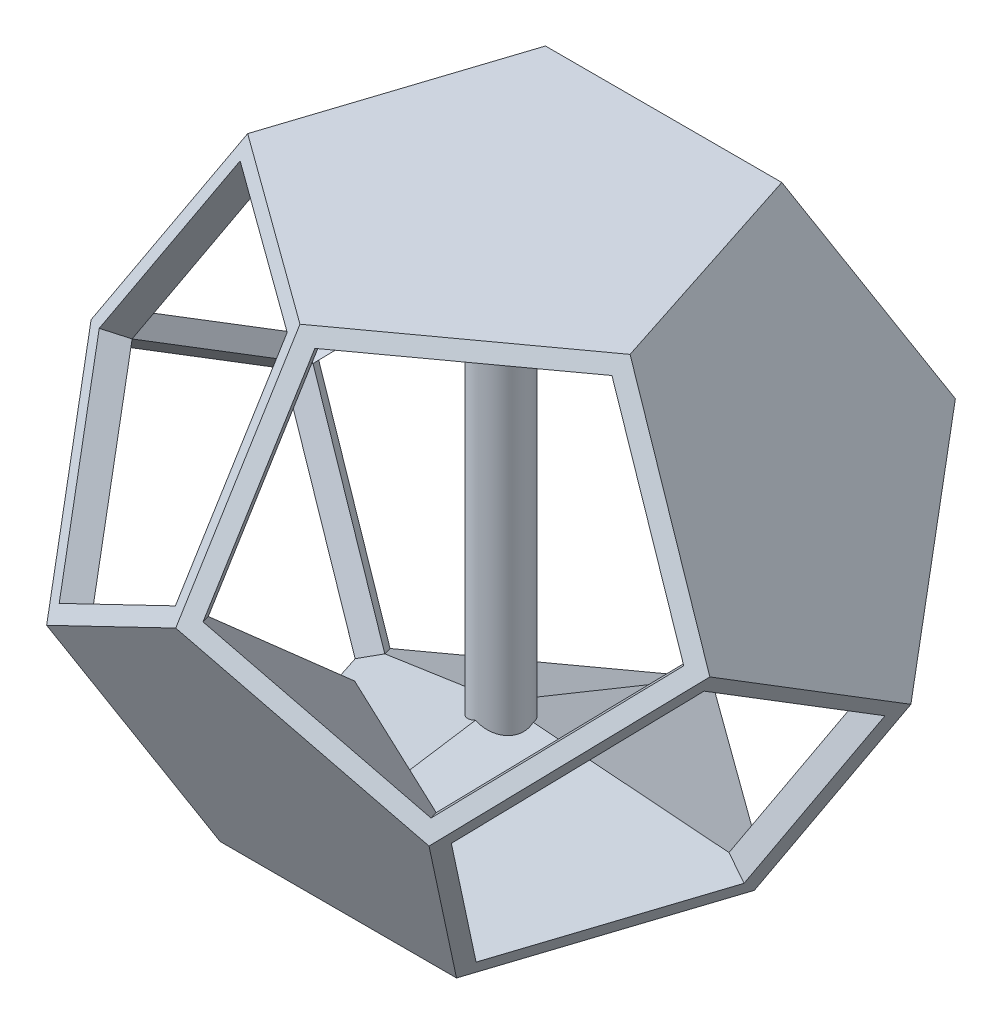
from build123d import *

# Parameters (mm, degrees)
CREATION_EXTRUDE_DEPTH = 130.901699304
CREATION_EXTRUDE_TAPER = -26.56505118
SKETCH2_OUTSIDE_W      = 455.432
SKETCH2_OUTSIDE_H      = 443.246
CREATION_CUT_DEPTH     = 130.901699304
CREATION_CUT_TAPER     = 26.56505118
CUT_EXTRUDE_B_DEPTH    = 50.8
C_INV_DEPTH            = 50.8
CUT_EXTRUDE_D_DEPTH    = 50.8
D_INV_DEPTH            = 50.8
CUT_EXTRUDE_E_DEPTH    = 50.8
E_INV_DEPTH            = 50.8
CUT_EXTRUDE_F_DEPTH    = 50.8
F_INV_DEPTH            = 50.8
SKETCH17_R             = 6.35
BOSS_EXTRUDE1_DEPTH    = 127


with BuildPart() as part:
    # Sketch1 → creation_extrude (new body)
    with BuildSketch(Plane(origin=(0, 0, 0), x_dir=(1, 0, 0), z_dir=(0, 1, 0))):
        Polygon((0, 49.999999949), (-47.552825766, 15.450849703), (-29.389262585, -40.450849677), (29.389262585, -40.450849677), (47.552825766, 15.450849703), align=None)
    extrude(amount=CREATION_EXTRUDE_DEPTH, taper=CREATION_EXTRUDE_TAPER)

    # Sketch2 outside → creation_cut (cut)
    with BuildSketch(Plane(origin=(0, 130.901699304, 0), x_dir=(1, 0, 0), z_dir=(0, 1, 0))):
        with Locations((0, 12.5)):
            Rectangle(SKETCH2_OUTSIDE_W, SKETCH2_OUTSIDE_H)
        Polygon((0, -49.999999949), (47.552825766, -15.450849703), (29.389262585, 40.450849677), (-29.389262585, 40.450849677), (-47.552825766, -15.450849703), align=None, mode=Mode.SUBTRACT)
    extrude(amount=-CREATION_CUT_DEPTH, taper=CREATION_CUT_TAPER, mode=Mode.SUBTRACT)

    # Sketch5 → Cut-Extrude B (cut)
    with BuildSketch(Plane(origin=(0, 42.360679738, -84.721359466), x_dir=(-1, 0, 0), z_dir=(-9.08060963965006e-15, 0.4472135955455734, -0.8944271909771081))):
        Polygon((-42.797543189, 44.635254864), (1e-09, 13.541019643), (42.79754319, 44.635254866), (26.450336325, 94.946784308), (-26.450336327, 94.946784307), align=None)
    extrude(amount=-CUT_EXTRUDE_B_DEPTH, mode=Mode.SUBTRACT)

    # Sketch8 → C_inv (cut)
    with BuildSketch(Plane(origin=(-30.776835339, -16.180339872, 9.999999989), x_dir=(0.2446443083020028, 0.12861712429362696, 0.9610446387935747), z_dir=(-0.8506508083303469, -0.4472135955455736, 0.27639320224297786))):
        Polygon((-31.935023341, 77.848060657), (-22.992425992, 25.708717357), (29.358450763, 18.101689683), (52.77047459, 65.539631327), (14.889024305, 102.464919293), align=None)
    extrude(amount=-C_INV_DEPTH, mode=Mode.SUBTRACT)

    # Sketch9 → Cut-Extrude D (cut)
    with BuildSketch(Plane(origin=(49.797965648, 42.360679738, 68.541019594), x_dir=(0.8506508083603209, -0.27639320226847824, -0.44721359547279954), z_dir=(0.5257311121057348, 0.44721359554557366, 0.7236067977315217))):
        Polygon((-4.184405192, 98.473361345), (-54.495934634, 82.126154482), (-54.495934634, 29.22548183), (-4.184405192, 12.878274966), (26.90983003, 55.675818156), align=None)
    extrude(amount=-CUT_EXTRUDE_D_DEPTH, mode=Mode.SUBTRACT)

    # Sketch10 → D_inv (cut)
    with BuildSketch(Plane(origin=(-19.021130306, -16.180339872, -26.180339859), x_dir=(-0.8506508083603233, 0.27639320226847536, 0.44721359547279665), z_dir=(-0.5257311121057309, -0.44721359554557344, -0.7236067977315247))):
        Polygon((31.995934659, 98.473361351), (-18.315594783, 82.126154488), (-18.315594783, 29.225481836), (31.995934659, 12.878274972), (63.090169881, 55.675818162), align=None)
    extrude(amount=-D_INV_DEPTH, mode=Mode.SUBTRACT)

    # Sketch11 → Cut-Extrude E (cut)
    with BuildSketch(Plane(origin=(-49.797965648, 42.360679738, 68.541019594), x_dir=(0.8506508083603298, 0.2763932022684677, 0.447213595472789), z_dir=(-0.5257311121057203, 0.44721359554557355, 0.7236067977315324))):
        Polygon((4.184405192, 98.473361345), (-26.90983003, 55.675818156), (4.184405192, 12.878274966), (54.495934634, 29.22548183), (54.495934634, 82.126154482), align=None)
    extrude(amount=-CUT_EXTRUDE_E_DEPTH, mode=Mode.SUBTRACT)

    # Sketch12 → E_inv (cut)
    with BuildSketch(Plane(origin=(19.021130306, -16.180339872, -26.180339859), x_dir=(-0.8506508083603274, -0.27639320226847064, -0.44721359547279194), z_dir=(0.5257311121057243, -0.44721359554557355, -0.7236067977315294))):
        Polygon((-31.99593466, 98.473361351), (-63.090169881, 55.67581816), (-31.995934658, 12.878274972), (18.315594784, 29.225481837), (18.315594782, 82.126154489), align=None)
    extrude(amount=-E_INV_DEPTH, mode=Mode.SUBTRACT)

    # Sketch13 → Cut-Extrude F (cut)
    with BuildSketch(Plane(origin=(-80.574800989, 42.360679738, -26.180339862), x_dir=(-0.24464430830199108, 0.12861712429362016, 0.9610446387935785), z_dir=(-0.8506508083303513, 0.4472135955455735, -0.2763932022429644))):
        Polygon((-12.522250637, 97.763517637), (-35.934274461, 50.325575991), (1.947175826, 13.400288027), (48.771223471, 38.017146666), (39.828626119, 90.156489966), align=None)
    extrude(amount=-CUT_EXTRUDE_F_DEPTH, mode=Mode.SUBTRACT)

    # Sketch14 → F_inv (cut)
    with BuildSketch(Plane(origin=(30.776835339, -16.180339872, 9.999999989), x_dir=(0.2446443083019939, -0.12861712429362177, -0.9610446387935776), z_dir=(0.8506508083303502, -0.4472135955455736, 0.2763932022429676))):
        Polygon((-29.358450768, 18.101689686), (22.992425988, 25.708717353), (31.935023344, 77.848060652), (-14.889024299, 102.464919294), (-52.770474589, 65.539631333), align=None)
    extrude(amount=-F_INV_DEPTH, mode=Mode.SUBTRACT)


with BuildPart() as body_2:
    # of the pieces the cut leaves, the one that is kept (f_inv_keep)
    add(part.part.solids().sort_by_distance((0, 0, -49.999999949))[0])

    # Sketch17 → Boss-Extrude1 (add)
    with BuildSketch(Plane(origin=(0, 130.901699304, 0), x_dir=(1, 0, 0), z_dir=(0, 1, 0))):
        with Locations(Location((0, 0, 0), (0, 0, 270))):
            Circle(SKETCH17_R)
    extrude(amount=-BOSS_EXTRUDE1_DEPTH)


solid = body_2.part
